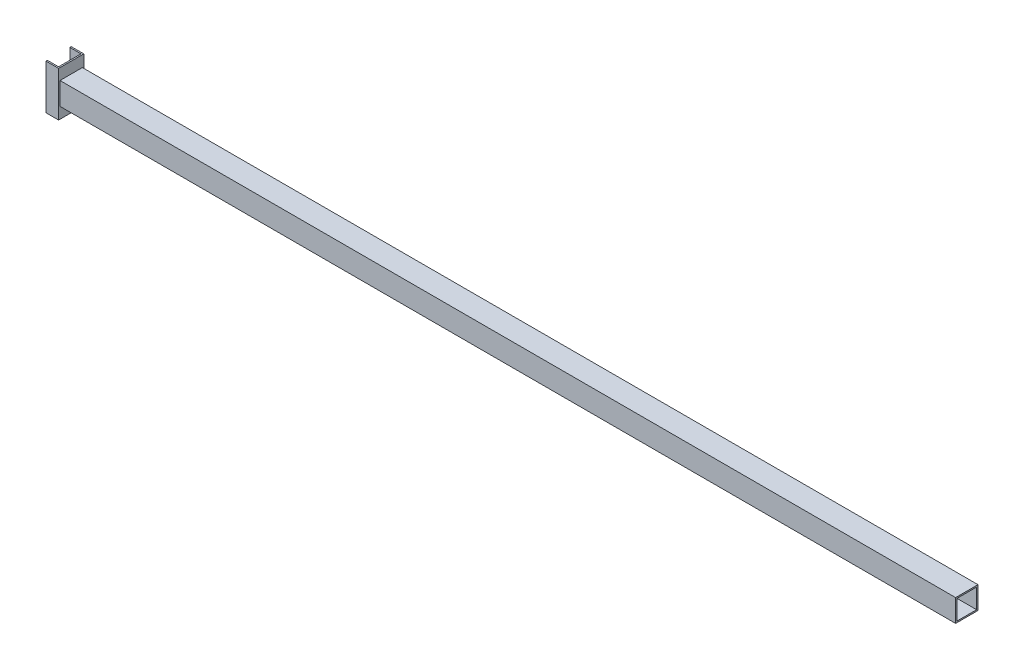
from build123d import *

# Parameters (mm, degrees)
SKETCH1_W           = 28.575
SKETCH1_H           = 50.8
BOSS_EXTRUDE1_DEPTH = 1.5875
BOSS_EXTRUDE2_DEPTH = 14.2875
SKETCH1_4_W         = 25.4
SKETCH1_4_H         = 25.4
SKETCH1_4_W_2       = 22.225
SKETCH1_4_H_2       = 22.225
BOSS_EXTRUDE3_DEPTH = 1016
BOSS_EXTRUDE4_DEPTH = 12.7
LPATTERN1_COUNT     = 2
LPATTERN1_PITCH     = 25.4


with BuildPart() as part:
    # Sketch1 → Boss-Extrude1 (new body)
    with BuildSketch(Plane(origin=(0, 0, 0), x_dir=(0, 0, -1), z_dir=(1, 0, 0))):
        Rectangle(SKETCH1_W, SKETCH1_H)
    extrude(amount=-BOSS_EXTRUDE1_DEPTH)

    # Sketch1<3> → Boss-Extrude2 (add)
    with BuildSketch(Plane(origin=(0, 0, 0), x_dir=(0, 0, -1), z_dir=(1, 0, 0))):
        Polygon((-12.7, 12.7), (-12.7, 25.4), (-14.2875, 25.4), (-14.2875, -25.4), (-12.7, -25.4), (-12.7, -12.7), align=None)
        Polygon((14.2875, 25.4), (12.7, 25.4), (12.7, 12.7), (12.7, -12.7), (12.7, -25.4), (14.2875, -25.4), align=None)
    extrude(amount=-BOSS_EXTRUDE2_DEPTH)

    # Sketch1<4> → Boss-Extrude3 (add)
    with BuildSketch(Plane(origin=(0, 0, 0), x_dir=(0, 0, -1), z_dir=(1, 0, 0))):
        Rectangle(SKETCH1_4_W, SKETCH1_4_H)
        Rectangle(SKETCH1_4_W_2, SKETCH1_4_H_2, mode=Mode.SUBTRACT)
    extrude(amount=BOSS_EXTRUDE3_DEPTH)

    # 3DSketch1 → Boss-Extrude4 (add)
    with BuildSketch(Plane(origin=(-1.5875, 12.7, -6.35), x_dir=(0, 1, 0), z_dir=(0, 0, 1))):
        Polygon((0, 0), (0, 3.175), (6.35, 0), align=None)
    boss_extrude4 = extrude(amount=BOSS_EXTRUDE4_DEPTH)

    # LPattern1: Boss-Extrude4 ×2
    with Locations(*[(0, -i * LPATTERN1_PITCH, 0) for i in range(1, LPATTERN1_COUNT)]):
        add(boss_extrude4)


solid = part.part
